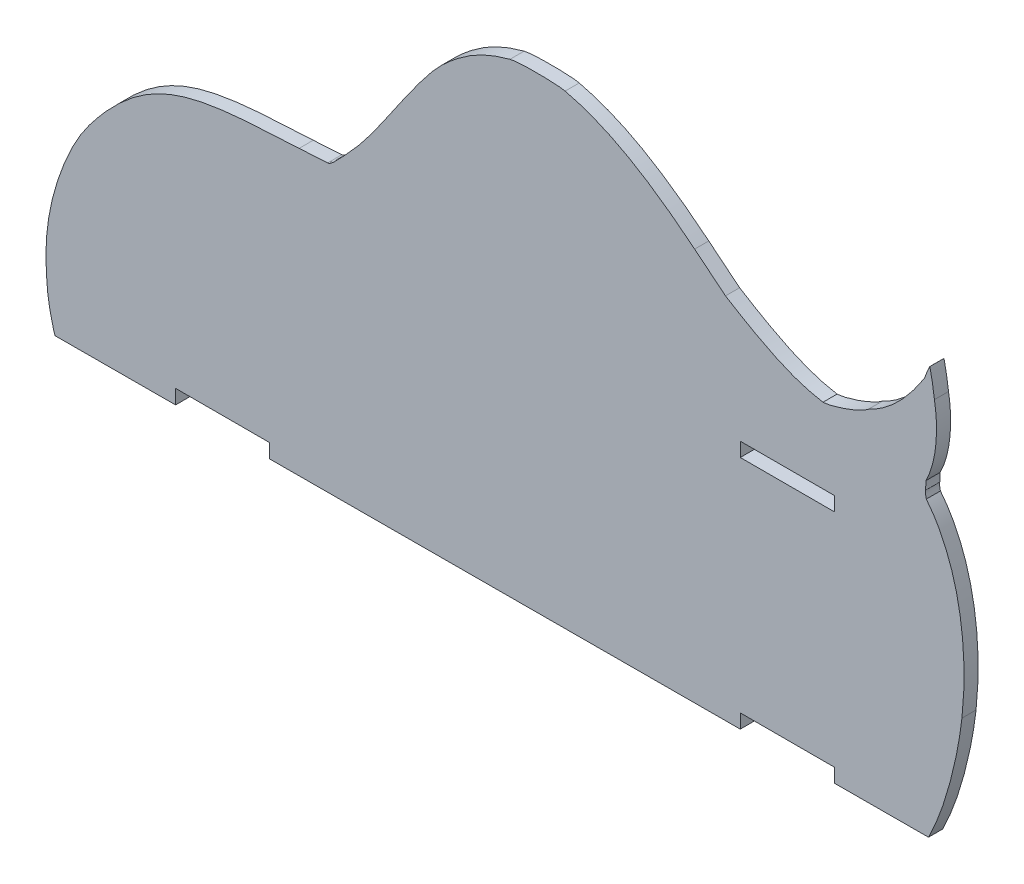
from build123d import *

# Parameters (mm, degrees)
SKETCH1_W           = 20
SKETCH1_H           = 3
BOSS_EXTRUDE1_DEPTH = 3


with BuildPart() as part:
    # Sketch1 → Boss-Extrude1 (new body)
    # profile 1 of 3: a face of its own
    with BuildSketch(Plane.XY):
        with BuildLine():
            add(Edge.make_bspline(
                [(240.469820829, 296.383844032), (236.651125345, 290.479775846), (232.928874324, 286.841309227), (228.632144795, 284.812613295)],
                knots=[0, 0, 0, 0, 1, 1, 1, 1], degree=3))
            add(Edge.make_bspline(
                [(228.632144795, 284.812613295), (226.861147306, 283.399689538), (221.392042444, 281.387343093), (218.93484187, 281.244531384)],
                knots=[0, 0, 0, 0, 1, 1, 1, 1], degree=3))
            add(Edge.make_bspline(
                [(218.93484187, 281.244531384), (213.142066592, 282.199369906), (207.621000721, 284.653770769), (198.217921477, 290.454290235)],
                knots=[0, 0, 0, 0, 1, 1, 1, 1], degree=3))
            add(Edge.make_bspline(
                [(198.217921477, 290.454290235), (196.173393477, 292.118481235), (193.224738477, 294.519464235), (191.665350477, 295.789808235)],
                knots=[0, 0, 0, 0, 1, 1, 1, 1], degree=3))
            add(Edge.make_bspline(
                [(191.665350477, 295.789808235), (181.123444477, 304.377742235), (172.648779477, 309.090312235), (164.131959477, 311.100493235)],
                knots=[0, 0, 0, 0, 1, 1, 1, 1], degree=3))
            add(Edge.make_bspline(
                [(164.131959477, 311.100493235), (162.075544477, 311.585852235), (154.282194477, 311.583190235), (152.412943477, 311.096855235)],
                knots=[0, 0, 0, 0, 1, 1, 1, 1], degree=3))
            add(Edge.make_bspline(
                [(152.412943477, 311.096855235), (146.791988477, 309.633287235), (142.504601477, 307.167024235), (137.901986477, 302.749608235)],
                knots=[0, 0, 0, 0, 1, 1, 1, 1], degree=3))
            add(Edge.make_bspline(
                [(137.901986477, 302.749608235), (135.553087477, 300.495235235), (132.370938477, 296.273870235), (126.391682477, 287.480322235)],
                knots=[0, 0, 0, 0, 1, 1, 1, 1], degree=3))
            add(Edge.make_bspline(
                [(126.391682477, 287.480322235), (122.648888477, 281.975879235), (120.611935477, 279.375243235), (117.201573477, 275.747032235)],
                knots=[0, 0, 0, 0, 1, 1, 1, 1], degree=3))
            add(Edge.make_bspline(
                [(117.201573477, 275.747032235), (114.779872477, 273.170633235), (114.274522477, 272.728335235), (113.673270477, 272.659053235)],
                knots=[0, 0, 0, 0, 1, 1, 1, 1], degree=3))
            add(Edge.make_bspline(
                [(113.673270477, 272.659053235), (113.287311477, 272.614543235), (110.559377477, 272.454465235), (107.611210477, 272.303276235)],
                knots=[0, 0, 0, 0, 1, 1, 1, 1], degree=3))
            add(Edge.make_bspline(
                [(107.611210477, 272.303276235), (86.346815477, 271.212768235), (75.919051477, 271.227091235), (63.008175477, 254.273392235)],
                knots=[0, 0, 0, 0, 1, 1, 1, 1], degree=3))
            add(Edge.make_bspline(
                [(63.008175477, 254.273392235), (58.796714477, 248.743189235), (54.645708477, 238.666261235), (53.930170477, 229.128885235)],
                knots=[0, 0, 0, 0, 1, 1, 1, 1], degree=3))
            add(Edge.make_bspline(
                [(53.930170477, 229.128885235), (53.721105477, 226.342367235), (53.792620477, 222.226585235), (54.187873477, 218.929577235)],
                knots=[0, 0, 0, 0, 1, 1, 1, 1], degree=3))
            add(Edge.make_bspline(
                [(54.187873477, 218.929577235), (54.490646477, 216.403965235), (55.330161477, 212.748448235), (55.771613477, 211.884964235)],
                knots=[0, 0, 0, 0, 1, 1, 1, 1], degree=3))
            Line((55.771613477, 211.884964235), (81.359563224, 211.955586631))
            Line((81.359563224, 211.955586631), (81.359563224, 215.010786361))
            Line((81.359563224, 215.010786361), (101.359563224, 215.010786361))
            Line((101.359563224, 215.010786361), (101.359563224, 212.010786361))
            Line((101.359563224, 212.010786361), (201.35903, 212.28678354))
            Line((201.35903, 212.28678354), (201.35903, 215.28678354))
            Line((201.35903, 215.28678354), (221.35903, 215.28678354))
            Line((221.35903, 215.28678354), (221.35903, 212.34198327))
            Line((221.35903, 212.34198327), (241.35903, 212.397183))
            add(Edge.make_bspline(
                [(241.35903, 212.397183), (244.629305861, 218.748817068), (247.40859442, 228.709873239), (248.46742676, 237.873897093)],
                knots=[0, 0, 0, 0, 1, 1, 1, 1], degree=3))
            add(Edge.make_bspline(
                [(248.46742676, 237.873897093), (250.079518862, 252.887800903), (247.215041867, 266.697425469), (240.891378893, 274.398057325)],
                knots=[0, 0, 0, 0, 1, 1, 1, 1], degree=3))
            add(Edge.make_bspline(
                [(240.891378893, 274.398057325), (240.698521086, 275.27358016), (240.643056085, 275.981882336), (240.76811836, 275.972073931)],
                knots=[0, 0, 0, 0, 1, 1, 1, 1], degree=3))
            add(Edge.make_bspline(
                [(240.76811836, 275.972073931), (240.748909131, 276.096033997), (240.769278751, 276.901273493), (240.813388464, 277.761500997)],
                knots=[0, 0, 0, 0, 1, 1, 1, 1], degree=3))
            add(Edge.make_bspline(
                [(240.813388464, 277.761500997), (242.927080797, 281.842540784), (243.601341236, 287.745758426), (242.61801967, 293.561188973)],
                knots=[0, 0, 0, 0, 1, 1, 1, 1], degree=3))
            add(Edge.make_bspline(
                [(242.61801967, 293.561188973), (242.415605619, 295.360351559), (241.753508901, 299.076632619), (241.623073366, 299.145691082)],
                knots=[0, 0, 0, 0, 1, 1, 1, 1], degree=3))
            add(Edge.make_bspline(
                [(241.623073366, 299.145691082), (241.578638706, 299.19165546), (241.059652967, 297.948834469), (240.469820829, 296.383844032)],
                knots=[0, 0, 0, 0, 1, 1, 1, 1], degree=3))
        make_face()
        with Locations((211.35903, 263.78678354)):
            Rectangle(SKETCH1_W, SKETCH1_H, mode=Mode.SUBTRACT)
        with BuildLine():
            add(Edge.make_bspline(
                [(201.843236026, 279.741376594), (201.523376635, 280.02936203), (200.901282099, 280.593624889), (199.543639419, 281.846281217), (197.721364001, 283.549658829), (195.33366628, 285.777696204), (191.919276726, 288.908047707), (187.264875178, 292.981443354), (181.210308448, 297.675476133), (174.816425919, 301.728836363), (168.187651337, 304.68610159), (162.530063372, 305.81688333), (157.984525923, 305.614260568), (153.530958932, 304.555467323), (148.375122164, 301.880565273), (142.705289246, 297.240779546), (137.461776484, 291.744535415), (132.597431172, 285.942234601), (128.850565667, 281.314306121), (126.048127718, 278.023842232), (124.052495255, 275.836492497), (122.490714258, 274.313065528), (121.53740178, 273.498180089), (121.111683759, 273.161071858), (120.789718866, 272.907682621), (119.931571273, 272.231329661), (118.510544623, 271.11196569), (117.254230449, 270.122097355), (116.625220784, 269.626522955)],
                knots=[-0.00190331, -0.00190331, -0.00190331, -0.00190331, 0.015021831, 0.031946973, 0.065797257, 0.09964754, 0.133497824, 0.201198391, 0.268898959, 0.336599526, 0.404300093, 0.47200066, 0.505850944, 0.539701228, 0.607401795, 0.675102362, 0.742802929, 0.810503496, 0.878204064, 0.912054347, 0.945904631, 0.979754915, 0.996680056, 1.000911342, 1.005142627, 1.013605198, 1.047455482, 1.081305765, 1.081305765, 1.081305765, 1.081305765], degree=3))
            Line((116.625220784, 269.626522955), (210.272280725, 269.626522955))
            Line((210.272280725, 269.626522955), (201.843236026, 279.741376594))
        make_face(mode=Mode.SUBTRACT)
    # profile 2 of 3: a face of its own
    with BuildSketch(Plane.XY):
        with BuildLine():
            Line((210.272280725, 269.626522955), (201.843236026, 279.741376594))
            add(Edge.make_bspline(
                [(201.843236026, 279.741376594), (201.523376635, 280.02936203), (200.901282099, 280.593624889), (199.543639419, 281.846281217), (197.721364001, 283.549658829), (195.33366628, 285.777696204), (191.919276726, 288.908047707), (187.264875178, 292.981443354), (181.210308448, 297.675476133), (174.816425919, 301.728836363), (168.187651337, 304.68610159), (162.530063372, 305.81688333), (157.984525923, 305.614260568), (153.530958932, 304.555467323), (148.375122164, 301.880565273), (142.705289246, 297.240779546), (137.461776484, 291.744535415), (132.597431172, 285.942234601), (128.850565667, 281.314306121), (126.048127718, 278.023842232), (124.052495255, 275.836492497), (122.490714258, 274.313065528), (121.53740178, 273.498180089), (121.111683759, 273.161071858), (120.789718866, 272.907682621), (119.931571273, 272.231329661), (118.510544623, 271.11196569), (117.254230449, 270.122097355), (116.625220784, 269.626522955)],
                knots=[-0.00190331, -0.00190331, -0.00190331, -0.00190331, 0.015021831, 0.031946973, 0.065797257, 0.09964754, 0.133497824, 0.201198391, 0.268898959, 0.336599526, 0.404300093, 0.47200066, 0.505850944, 0.539701228, 0.607401795, 0.675102362, 0.742802929, 0.810503496, 0.878204064, 0.912054347, 0.945904631, 0.979754915, 0.996680056, 1.000911342, 1.005142627, 1.013605198, 1.047455482, 1.081305765, 1.081305765, 1.081305765, 1.081305765], degree=3))
            Line((116.625220784, 269.626522955), (210.272280725, 269.626522955))
        make_face()
        with BuildLine():
            add(Edge.make_bspline(
                [(200.398528045, 278.350926301), (190.867543037, 286.932149658), (155.755536364, 324.252253924), (131.48134266, 278.784976047), (122.395449235, 271.626522955)],
                knots=[0, 0, 0, 0, 0.511040789, 1, 1, 1, 1], degree=3))
            Line((122.395449235, 271.626522955), (206.0021975, 271.626522955))
            Line((206.0021975, 271.626522955), (200.398528045, 278.350926301))
        make_face(mode=Mode.SUBTRACT)
    # profile 3 of 3: a face of its own
    with BuildSketch(Plane.XY):
        with BuildLine():
            Line((206.0021975, 271.626522955), (200.398528045, 278.350926301))
            add(Edge.make_bspline(
                [(200.398528045, 278.350926301), (190.867543037, 286.932149658), (155.755536364, 324.252253924), (131.48134266, 278.784976047), (122.395449235, 271.626522955)],
                knots=[0, 0, 0, 0, 0.511040789, 1, 1, 1, 1], degree=3))
            Line((122.395449235, 271.626522955), (206.0021975, 271.626522955))
        make_face()
    extrude(amount=BOSS_EXTRUDE1_DEPTH)


solid = part.part
